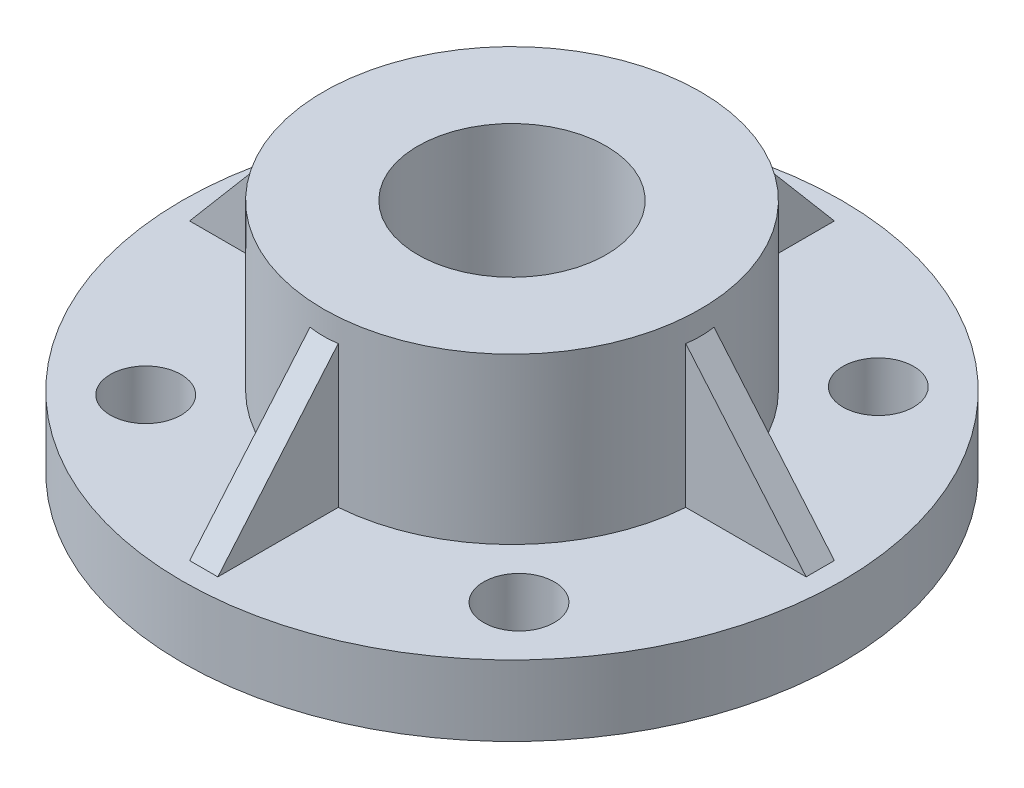
from build123d import *

# Parameters (mm, degrees)
RIB1_REACH              = 112.498
SKETCH2_WALL_W          = 261.642553204
SKETCH2_WALL_H          = 6
CUT_EXTRUDE2_DEPTH      = 111.497997453
CUT_EXTRUDE2_DEPTH_BACK = 10
SKETCH4_R               = 7.5
CIRPATTERN6_COUNT       = 4


with BuildPart() as part:
    # Sketch1 → Revolve1 (revolve)
    with BuildSketch(Plane.XY, mode=Mode.PRIVATE) as revolve1_sk:
        Polygon((20, 49.089789582), (20, -0.910210418), (70, -0.910210418), (70, 14.089789582), (40, 14.089789582), (40, 49.089789582), align=None)
    revolve(revolve1_sk.sketch.rotate(Axis((0, 0, 0), (0, 1, 0)), 90), axis=Axis((0, 0, 0), (0, 1, 0)))

    # Sketch2 wall → Rib1 (add, up to next)
    with BuildSketch(Plane(origin=(-52.5, 29.354148536, 0), x_dir=(0.646888134458, 0.76258490773, 0), z_dir=(-0.76258490773, 0.646888134458, 0)), mode=Mode.PRIVATE) as rib1_sk1:
        Rectangle(SKETCH2_WALL_W, SKETCH2_WALL_H)
    rib1_tool1 = extrude(rib1_sk1.sketch, amount=-RIB1_REACH, mode=Mode.PRIVATE) - part.part
    rib1 = rib1_tool1.solids().sort_by_distance((-52.5, 29.354148536, 0))[0]
    add(rib1)

    # Sketch4 → Cut-Extrude2 (cut, two sides: drawn at the far end of the back side and taken through both)
    with BuildSketch(Plane(origin=(0, 0, 0), x_dir=(1, 0, 0), z_dir=(0, 1, 0)).offset(-CUT_EXTRUDE2_DEPTH_BACK)):
        with Locations(Location((-39.62662351, 38.140932201, 0), (0, 0, 270))):
            Circle(SKETCH4_R)
        with Locations(Location((38.140932201, 39.62662351, 0), (0, 0, 270))):
            Circle(SKETCH4_R)
        with Locations(Location((39.62662351, -38.140932201, 0), (0, 0, 270))):
            Circle(SKETCH4_R)
        with Locations(Location((-38.140932201, -39.62662351, 0), (0, 0, 270))):
            Circle(SKETCH4_R)
    extrude(amount=CUT_EXTRUDE2_DEPTH + CUT_EXTRUDE2_DEPTH_BACK, mode=Mode.SUBTRACT)

    # CirPattern6: Rib1 ×4 about axis
    cirpattern6_axis = Axis((0, 0, 0), (0, 1, 0))
    for i in range(1, CIRPATTERN6_COUNT):
        add(rib1.rotate(cirpattern6_axis, i * 360 / CIRPATTERN6_COUNT))


solid = part.part
